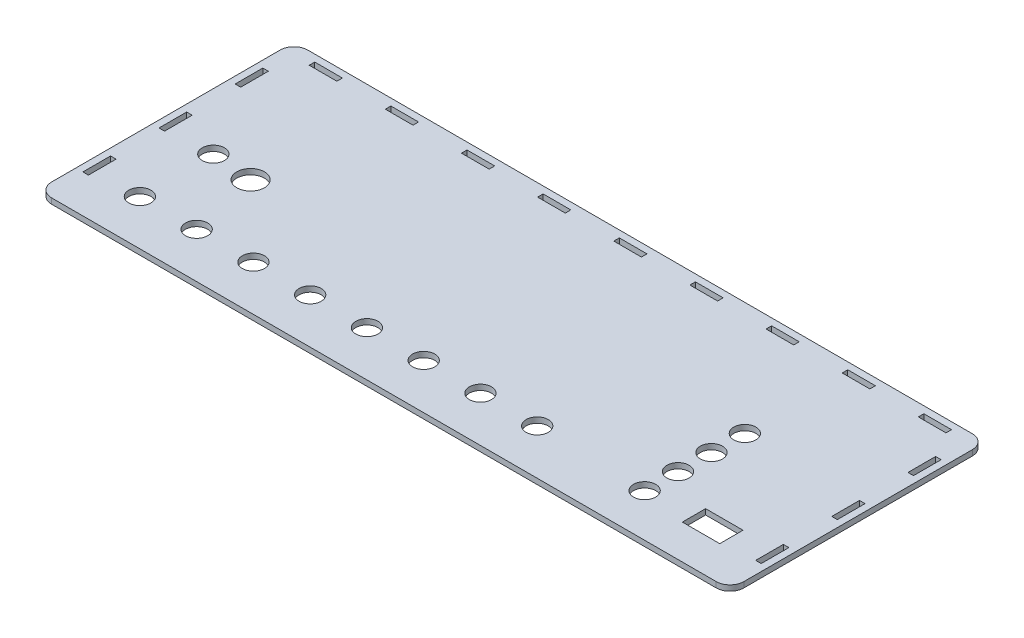
from build123d import *

# Parameters (mm, degrees)
SKETCH2_W                   = 500
SKETCH2_H                   = 185
BASE_DEPTH                  = 4
SKETCH3_W                   = 20
SKETCH3_H                   = 4
TOP_HOLE_DEFINITION_DEPTH   = 267.593792126
TOP_HOLE_PATTERN_COUNT      = 5
TOP_HOLE_PATTERN_PITCH      = 55
TOP_HOLE_PATTERN_COL_COUNT  = 5
TOP_HOLE_PATTERN_COL_PITCH  = 55
SKETCH4_W                   = 4
SKETCH4_H                   = 20
LEFT_HOLE_DEFINITION_DEPTH  = 267.593792126
LEFT_HOLE_PATTERN_COUNT     = 2
LEFT_HOLE_PATTERN_PITCH     = 55
LEFT_HOLE_PATTERN_COL_COUNT = 2
LEFT_HOLE_PATTERN_COL_PITCH = 55
FILLET1_R                   = 10
MIRROR2_COPY_1_SKETCH_W     = 4
MIRROR2_COPY_1_SKETCH_H     = 20
MIRROR2_COPY_1_DEPTH        = 267.593792126
MIRROR2_COPY_2_SKETCH_W     = 4
MIRROR2_COPY_2_SKETCH_H     = 20
MIRROR2_COPY_2_DEPTH        = 267.593792126
SKETCH7_R                   = 8
SKETCH7_R_2                 = 10
CUT_EXTRUDE5_DEPTH          = 267.593792126
SKETCH8_W                   = 27
SKETCH8_H                   = 16.8
CUT_EXTRUDE6_DEPTH          = 267.593792126


with BuildPart() as part:
    # Sketch2 → Base (new body)
    with BuildSketch(Plane(origin=(0, 0, 0), x_dir=(1, 0, 0), z_dir=(0, 1, 0))):
        Rectangle(SKETCH2_W, SKETCH2_H)
    extrude(amount=BASE_DEPTH)

    # Sketch3 → Top Hole Definition (cut, through all)
    with BuildSketch(Plane(origin=(0, 4, 0), x_dir=(1, 0, 0), z_dir=(0, 1, 0))):
        with Locations((0, 85.5)):
            Rectangle(SKETCH3_W, SKETCH3_H)
    top_hole_definition = extrude(amount=-TOP_HOLE_DEFINITION_DEPTH, mode=Mode.SUBTRACT)

    # Top Hole Pattern: Top Hole Definition ×5
    with Locations(*[(-i * TOP_HOLE_PATTERN_PITCH, 0, 0) for i in range(1, TOP_HOLE_PATTERN_COUNT)]):
        add(top_hole_definition, mode=Mode.SUBTRACT)

    # Top Hole Pattern col: Top Hole Definition ×5
    with Locations(*[(i * TOP_HOLE_PATTERN_COL_PITCH, 0, 0) for i in range(1, TOP_HOLE_PATTERN_COL_COUNT)]):
        add(top_hole_definition, mode=Mode.SUBTRACT)

    # Sketch4 → Left Hole Definition (cut, through all)
    with BuildSketch(Plane(origin=(0, 4, 0), x_dir=(1, 0, 0), z_dir=(0, 1, 0))):
        with Locations((-243, 0)):
            Rectangle(SKETCH4_W, SKETCH4_H)
    left_hole_definition = extrude(amount=-LEFT_HOLE_DEFINITION_DEPTH, mode=Mode.SUBTRACT)

    # Left Hole Pattern: Left Hole Definition ×2
    with Locations(*[(0, 0, -i * LEFT_HOLE_PATTERN_PITCH) for i in range(1, LEFT_HOLE_PATTERN_COUNT)]):
        add(left_hole_definition, mode=Mode.SUBTRACT)

    # Left Hole Pattern col: Left Hole Definition ×2
    with Locations(*[(0, 0, i * LEFT_HOLE_PATTERN_COL_PITCH) for i in range(1, LEFT_HOLE_PATTERN_COL_COUNT)]):
        add(left_hole_definition, mode=Mode.SUBTRACT)

    # Fillet1
    fillet1_edges = [part.edges().sort_by_distance(p)[0] for p in [
        (-250, 2, -92.5),
        (250, 2, -92.5),
        (250, 2, 92.5),
        (-250, 2, 92.5),
    ]]
    fillet(fillet1_edges, radius=FILLET1_R)

    # Mirror2: Left Hole Definition across plane
    add(left_hole_definition.mirror(Plane(origin=(0, 0, 0), x_dir=(0, 0, 1), z_dir=(1, 0, 0))), mode=Mode.SUBTRACT)

    # Mirror2 copy 1 sketch → Mirror2 copy 1 (cut, through all)
    with BuildSketch(Plane(origin=(0, 4, -55), x_dir=(-1, 0, 0), z_dir=(0, 1, 0))):
        with Locations((-243, 0)):
            Rectangle(MIRROR2_COPY_1_SKETCH_W, MIRROR2_COPY_1_SKETCH_H)
    extrude(amount=-MIRROR2_COPY_1_DEPTH, mode=Mode.SUBTRACT)

    # Mirror2 copy 2 sketch → Mirror2 copy 2 (cut, through all)
    with BuildSketch(Plane(origin=(0, 4, 55), x_dir=(-1, 0, 0), z_dir=(0, 1, 0))):
        with Locations((-243, 0)):
            Rectangle(MIRROR2_COPY_2_SKETCH_W, MIRROR2_COPY_2_SKETCH_H)
    extrude(amount=-MIRROR2_COPY_2_DEPTH, mode=Mode.SUBTRACT)

    # Sketch7 → Cut-Extrude5 (cut, through all)
    with BuildSketch(Plane.XZ):
        with Locations(Location((-209, 59.798294078, 0), (0, 0, 270))):
            Circle(SKETCH7_R)
        with Locations(Location((-168, 59.798294078, 0), (0, 0, 270))):
            Circle(SKETCH7_R)
        with Locations(Location((-127, 59.798294078, 0), (0, 0, 270))):
            Circle(SKETCH7_R)
        with Locations(Location((-86, 59.798294078, 0), (0, 0, 270))):
            Circle(SKETCH7_R)
        with Locations(Location((-45, 59.798294078, 0), (0, 0, 270))):
            Circle(SKETCH7_R)
        with Locations(Location((-4, 59.798294078, 0), (0, 0, 270))):
            Circle(SKETCH7_R)
        with Locations(Location((37, 59.798294078, 0), (0, 0, 270))):
            Circle(SKETCH7_R)
        with Locations(Location((78, 59.798294078, 0), (0, 0, 270))):
            Circle(SKETCH7_R)
        with Locations(Location((-179.5, 9.310158007, 0), (0, 0, 270))):
            Circle(SKETCH7_R_2)
        with Locations(Location((-209, 6.747125767, 0), (0, 0, 270))):
            Circle(SKETCH7_R)
        with Locations(Location((157.298294078, 61.5, 0), (0, 0, 270))):
            Circle(SKETCH7_R)
        with Locations(Location((157.431778922, 37.500371215, 0), (0, 0, 270))):
            Circle(SKETCH7_R)
        with Locations(Location((157.565263767, 13.500742431, 0), (0, 0, 270))):
            Circle(SKETCH7_R)
        with Locations(Location((157.698748611, -10.498886354, 0), (0, 0, 270))):
            Circle(SKETCH7_R)
    extrude(amount=-CUT_EXTRUDE5_DEPTH, mode=Mode.SUBTRACT)

    # Sketch8 → Cut-Extrude6 (cut, through all)
    with BuildSketch(Plane.XZ):
        with Locations((204.065263766, 59.1)):
            Rectangle(SKETCH8_W, SKETCH8_H)
    extrude(amount=-CUT_EXTRUDE6_DEPTH, mode=Mode.SUBTRACT)


solid = part.part
